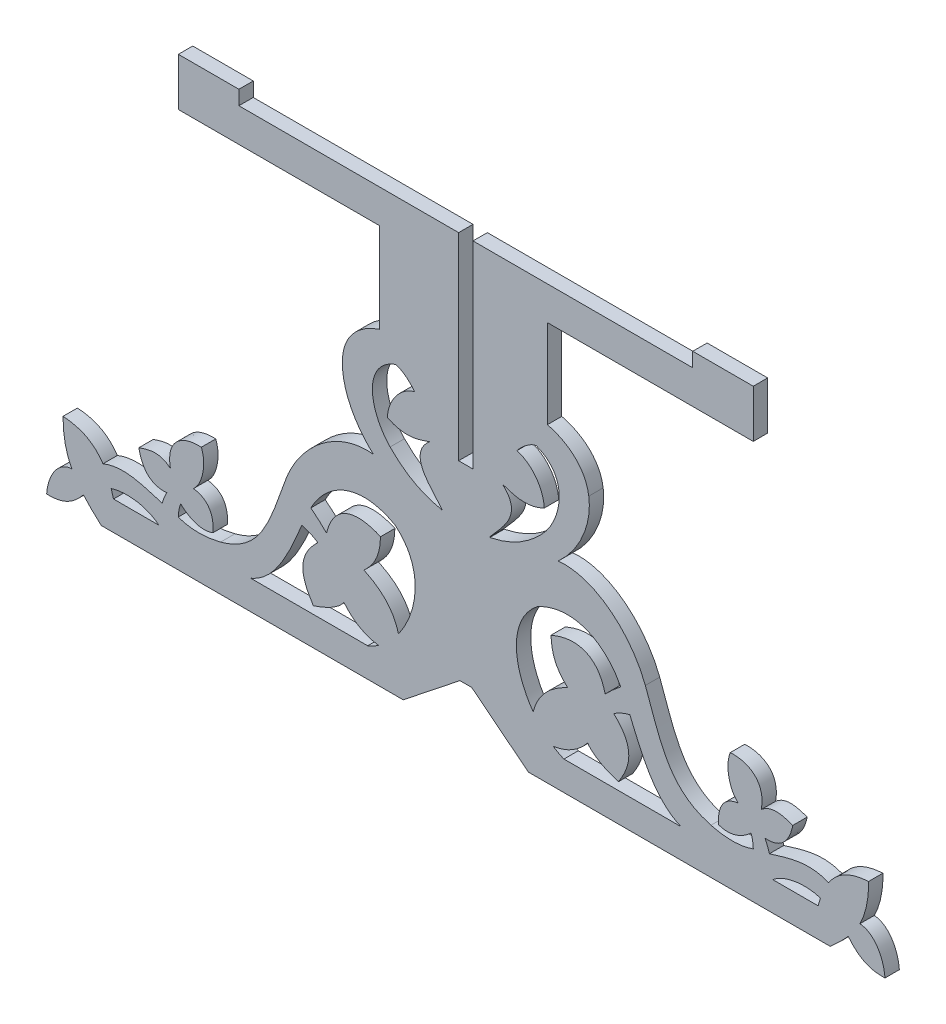
from build123d import *

# Parameters (mm, degrees)
RESSALTO_EXTRUS_O1_DEPTH = 2


with BuildPart() as part:
    # Model → Ressalto-extrusão1 (new body)
    with BuildSketch(Plane.XY):
        with BuildLine():
            Line((-10.7231, -37.6762), (-10.7231, -25.1897))
            Line((-10.7231, -25.1897), (-38.7386, -25.1897))
            add(Edge.make_bspline(
                [(-38.7386, -25.1897), (-38.7386, -22.9711), (-38.7386, -20.7524), (-38.7386, -18.5338)],
                knots=[0.360655738, 0.360655738, 0.360655738, 0.360655738, 0.37704918, 0.37704918, 0.37704918, 0.37704918], degree=3))
            Line((-38.7386, -18.5338), (-30.3175, -18.5338))
            Line((-30.3175, -18.5338), (-30.3175, -20.523))
            Line((-30.3175, -20.523), (0.2614, -20.523))
            Line((0.2614, -20.523), (0.2614, -48.0172))
            Line((0.2614, -48.0172), (2.2614, -48.0172))
            Line((2.2614, -48.0172), (2.2614, -20.523))
            Line((2.2614, -20.523), (32.8404, -20.523))
            Line((32.8404, -20.523), (32.8404, -18.5338))
            Line((32.8404, -18.5338), (41.2614, -18.5338))
            add(Edge.make_bspline(
                [(41.2614, -18.5338), (41.2614, -20.7524), (41.2614, -22.9711), (41.2614, -25.1897)],
                knots=[0.524590164, 0.524590164, 0.524590164, 0.524590164, 0.540983607, 0.540983607, 0.540983607, 0.540983607], degree=3))
            Line((41.2614, -25.1897), (12.6103, -25.1897))
            Line((12.6103, -25.1897), (12.6103, -37.4982))
            add(Edge.make_bspline(
                [(12.6103, -37.4982), (15.3469, -38.1638), (17.9338, -40.0649), (18.3727, -43.2265)],
                knots=[0.573770492, 0.573770492, 0.573770492, 0.573770492, 0.590163934, 0.590163934, 0.590163934, 0.590163934], degree=3))
            add(Edge.make_bspline(
                [(18.3727, -43.2265), (18.8013, -46.3127), (17.3679, -50.2251), (14.1216, -53.1702)],
                knots=[0.590163934, 0.590163934, 0.590163934, 0.590163934, 0.606557377, 0.606557377, 0.606557377, 0.606557377], degree=3))
            add(Edge.make_bspline(
                [(14.1216, -53.1702), (19.3303, -52.6163), (24.3698, -57.1289), (26.2431, -62.1023)],
                knots=[0.606557377, 0.606557377, 0.606557377, 0.606557377, 0.62295082, 0.62295082, 0.62295082, 0.62295082], degree=3))
            add(Edge.make_bspline(
                [(26.2431, -62.1023), (28.3786, -67.7721), (29.4175, -72.7859), (35.3799, -74.3775)],
                knots=[0.62295082, 0.62295082, 0.62295082, 0.62295082, 0.639344262, 0.639344262, 0.639344262, 0.639344262], degree=3))
            add(Edge.make_bspline(
                [(35.3799, -74.3775), (37.3294, -74.898), (39.4414, -74.984), (41.2622, -74.294)],
                knots=[0.639344262, 0.639344262, 0.639344262, 0.639344262, 0.655737705, 0.655737705, 0.655737705, 0.655737705], degree=3))
            add(Edge.make_bspline(
                [(41.2622, -74.294), (41.2806, -73.728), (41.1153, -72.9489), (40.9405, -72.5501)],
                knots=[0.655737705, 0.655737705, 0.655737705, 0.655737705, 0.672131148, 0.672131148, 0.672131148, 0.672131148], degree=3))
            add(Edge.make_bspline(
                [(40.9405, -72.5501), (39.6049, -73.7999), (37.9821, -74.3589), (36.4572, -73.7949)],
                knots=[0.672131148, 0.672131148, 0.672131148, 0.672131148, 0.68852459, 0.68852459, 0.68852459, 0.68852459], degree=3))
            add(Edge.make_bspline(
                [(36.4572, -73.7949), (36.2713, -72.4111), (36.6557, -70.1006), (39.179, -69.821)],
                knots=[0.68852459, 0.68852459, 0.68852459, 0.68852459, 0.704918033, 0.704918033, 0.704918033, 0.704918033], degree=3))
            add(Edge.make_bspline(
                [(39.179, -69.821), (37.9997, -68.8716), (37.2891, -66.2296), (38.0621, -64.285)],
                knots=[0.704918033, 0.704918033, 0.704918033, 0.704918033, 0.721311475, 0.721311475, 0.721311475, 0.721311475], degree=3))
            add(Edge.make_bspline(
                [(38.0621, -64.285), (40.7476, -64.1295), (43.0052, -65.6416), (42.3684, -69.0009)],
                knots=[0.721311475, 0.721311475, 0.721311475, 0.721311475, 0.737704918, 0.737704918, 0.737704918, 0.737704918], degree=3))
            add(Edge.make_bspline(
                [(42.3684, -69.0009), (43.6758, -67.8762), (45.0295, -68.0604), (46.7666, -68.7027)],
                knots=[0.737704918, 0.737704918, 0.737704918, 0.737704918, 0.754098361, 0.754098361, 0.754098361, 0.754098361], degree=3))
            add(Edge.make_bspline(
                [(46.7666, -68.7027), (46.3384, -70.7839), (45.2619, -72.3576), (42.8773, -72.1812)],
                knots=[0.754098361, 0.754098361, 0.754098361, 0.754098361, 0.770491803, 0.770491803, 0.770491803, 0.770491803], degree=3))
            add(Edge.make_bspline(
                [(42.8773, -72.1812), (43.2089, -72.8324), (43.3627, -73.2163), (43.5091, -73.7542)],
                knots=[0.770491803, 0.770491803, 0.770491803, 0.770491803, 0.786885246, 0.786885246, 0.786885246, 0.786885246], degree=3))
            add(Edge.make_bspline(
                [(43.5091, -73.7542), (46.2628, -72.9249), (48.9338, -71.9547), (51.7513, -73.1269)],
                knots=[0.786885246, 0.786885246, 0.786885246, 0.786885246, 0.803278689, 0.803278689, 0.803278689, 0.803278689], degree=3))
            add(Edge.make_bspline(
                [(51.7513, -73.1269), (52.9966, -71.2581), (54.7969, -70.3509), (57.3123, -70.1879)],
                knots=[0.803278689, 0.803278689, 0.803278689, 0.803278689, 0.819672131, 0.819672131, 0.819672131, 0.819672131], degree=3))
            add(Edge.make_bspline(
                [(57.3123, -70.1879), (57.3204, -72.5861), (56.8825, -74.3809), (56.0957, -75.8997)],
                knots=[0.819672131, 0.819672131, 0.819672131, 0.819672131, 0.836065574, 0.836065574, 0.836065574, 0.836065574], degree=3))
            add(Edge.make_bspline(
                [(56.0957, -75.8997), (57.9369, -75.9909), (59.3915, -78.0981), (59.5947, -80.6857)],
                knots=[0.836065574, 0.836065574, 0.836065574, 0.836065574, 0.852459016, 0.852459016, 0.852459016, 0.852459016], degree=3))
            add(Edge.make_bspline(
                [(59.5947, -80.6857), (57.7047, -80.7554), (56.1272, -80.2428), (54.5438, -78.3099)],
                knots=[0.852459016, 0.852459016, 0.852459016, 0.852459016, 0.868852459, 0.868852459, 0.868852459, 0.868852459], degree=3))
            add(Edge.make_bspline(
                [(54.5438, -78.3099), (54.5231, -78.2819), (54.5016, -78.2553), (54.4806, -78.2277)],
                knots=[0.868852459, 0.868852459, 0.868852459, 0.868852459, 0.885245902, 0.885245902, 0.885245902, 0.885245902], degree=3))
            add(Edge.make_bspline(
                [(54.4806, -78.2277), (53.7575, -79.0574), (52.9166, -79.8491), (51.9814, -80.6856)],
                knots=[0.885245902, 0.885245902, 0.885245902, 0.885245902, 0.901639344, 0.901639344, 0.901639344, 0.901639344], degree=3))
            Line((51.9814, -80.6856), (9.9729, -80.6856))
            Line((9.9729, -80.6856), (2.0788, -74.4249))
            Line((2.0788, -74.4249), (0.4441, -74.4249))
            Line((0.4441, -74.4249), (-7.45, -80.6856))
            Line((-7.45, -80.6856), (-49.4585, -80.6856))
            add(Edge.make_bspline(
                [(-49.4585, -80.6856), (-50.3937, -79.8491), (-51.2347, -79.0574), (-51.9577, -78.2277)],
                knots=[0, 0, 0, 0, 0.016393443, 0.016393443, 0.016393443, 0.016393443], degree=3))
            add(Edge.make_bspline(
                [(-51.9577, -78.2277), (-51.9788, -78.2553), (-52.0002, -78.2819), (-52.021, -78.3099)],
                knots=[0.016393443, 0.016393443, 0.016393443, 0.016393443, 0.032786885, 0.032786885, 0.032786885, 0.032786885], degree=3))
            add(Edge.make_bspline(
                [(-52.021, -78.3099), (-53.6044, -80.2428), (-55.1819, -80.7554), (-57.0719, -80.6857)],
                knots=[0.032786885, 0.032786885, 0.032786885, 0.032786885, 0.049180328, 0.049180328, 0.049180328, 0.049180328], degree=3))
            add(Edge.make_bspline(
                [(-57.0719, -80.6857), (-56.8686, -78.0981), (-55.414, -75.9909), (-53.5728, -75.8997)],
                knots=[0.049180328, 0.049180328, 0.049180328, 0.049180328, 0.06557377, 0.06557377, 0.06557377, 0.06557377], degree=3))
            add(Edge.make_bspline(
                [(-53.5728, -75.8997), (-54.3597, -74.3809), (-54.7976, -72.5861), (-54.7895, -70.1879)],
                knots=[0.06557377, 0.06557377, 0.06557377, 0.06557377, 0.081967213, 0.081967213, 0.081967213, 0.081967213], degree=3))
            add(Edge.make_bspline(
                [(-54.7895, -70.1879), (-52.2741, -70.3509), (-50.4738, -71.2581), (-49.2284, -73.1269)],
                knots=[0.081967213, 0.081967213, 0.081967213, 0.081967213, 0.098360656, 0.098360656, 0.098360656, 0.098360656], degree=3))
            add(Edge.make_bspline(
                [(-49.2284, -73.1269), (-46.411, -71.9547), (-43.74, -72.9249), (-40.9862, -73.7542)],
                knots=[0.098360656, 0.098360656, 0.098360656, 0.098360656, 0.114754098, 0.114754098, 0.114754098, 0.114754098], degree=3))
            add(Edge.make_bspline(
                [(-40.9862, -73.7542), (-40.8398, -73.2163), (-40.686, -72.8324), (-40.3544, -72.1812)],
                knots=[0.114754098, 0.114754098, 0.114754098, 0.114754098, 0.131147541, 0.131147541, 0.131147541, 0.131147541], degree=3))
            add(Edge.make_bspline(
                [(-40.3544, -72.1812), (-42.739, -72.3576), (-43.8155, -70.7839), (-44.2438, -68.7027)],
                knots=[0.131147541, 0.131147541, 0.131147541, 0.131147541, 0.147540984, 0.147540984, 0.147540984, 0.147540984], degree=3))
            add(Edge.make_bspline(
                [(-44.2438, -68.7027), (-42.5066, -68.0604), (-41.153, -67.8762), (-39.8456, -69.0009)],
                knots=[0.147540984, 0.147540984, 0.147540984, 0.147540984, 0.163934426, 0.163934426, 0.163934426, 0.163934426], degree=3))
            add(Edge.make_bspline(
                [(-39.8456, -69.0009), (-40.4823, -65.6416), (-38.2247, -64.1295), (-35.5393, -64.285)],
                knots=[0.163934426, 0.163934426, 0.163934426, 0.163934426, 0.180327869, 0.180327869, 0.180327869, 0.180327869], degree=3))
            add(Edge.make_bspline(
                [(-35.5393, -64.285), (-34.7662, -66.2296), (-35.4768, -68.8716), (-36.6561, -69.821)],
                knots=[0.180327869, 0.180327869, 0.180327869, 0.180327869, 0.196721311, 0.196721311, 0.196721311, 0.196721311], degree=3))
            add(Edge.make_bspline(
                [(-36.6561, -69.821), (-34.1328, -70.1006), (-33.7484, -72.4111), (-33.9344, -73.7949)],
                knots=[0.196721311, 0.196721311, 0.196721311, 0.196721311, 0.213114754, 0.213114754, 0.213114754, 0.213114754], degree=3))
            add(Edge.make_bspline(
                [(-33.9344, -73.7949), (-35.4592, -74.3589), (-37.082, -73.7999), (-38.4177, -72.5501)],
                knots=[0.213114754, 0.213114754, 0.213114754, 0.213114754, 0.229508197, 0.229508197, 0.229508197, 0.229508197], degree=3))
            add(Edge.make_bspline(
                [(-38.4177, -72.5501), (-38.5924, -72.9489), (-38.7578, -73.728), (-38.7393, -74.294)],
                knots=[0.229508197, 0.229508197, 0.229508197, 0.229508197, 0.245901639, 0.245901639, 0.245901639, 0.245901639], degree=3))
            add(Edge.make_bspline(
                [(-38.7393, -74.294), (-36.9185, -74.984), (-34.8066, -74.898), (-32.8571, -74.3775)],
                knots=[0.245901639, 0.245901639, 0.245901639, 0.245901639, 0.262295082, 0.262295082, 0.262295082, 0.262295082], degree=3))
            add(Edge.make_bspline(
                [(-32.8571, -74.3775), (-26.8946, -72.7859), (-25.8557, -67.7721), (-23.7202, -62.1023)],
                knots=[0.262295082, 0.262295082, 0.262295082, 0.262295082, 0.278688525, 0.278688525, 0.278688525, 0.278688525], degree=3))
            add(Edge.make_bspline(
                [(-23.7202, -62.1023), (-21.8469, -57.1289), (-16.8074, -52.6163), (-11.5988, -53.1702)],
                knots=[0.278688525, 0.278688525, 0.278688525, 0.278688525, 0.295081967, 0.295081967, 0.295081967, 0.295081967], degree=3))
            add(Edge.make_bspline(
                [(-11.5988, -53.1702), (-14.8451, -50.2251), (-16.2784, -46.3127), (-15.8499, -43.2265)],
                knots=[0.295081967, 0.295081967, 0.295081967, 0.295081967, 0.31147541, 0.31147541, 0.31147541, 0.31147541], degree=3))
            add(Edge.make_bspline(
                [(-15.8499, -43.2265), (-15.4451, -40.3111), (-13.2139, -38.4676), (-10.7231, -37.6762)],
                knots=[0.31147541, 0.31147541, 0.31147541, 0.31147541, 0.327868852, 0.327868852, 0.327868852, 0.327868852], degree=3))
        make_face()
        with BuildLine():
            Line((4.593, -55.0228), (4.593, -55.1006))
            add(Edge.make_bspline(
                [(4.593, -55.1006), (7.4607, -54.4947), (9.6337, -53.3337), (11.7968, -51.1256)],
                knots=[0.111111111, 0.111111111, 0.111111111, 0.111111111, 0.222222222, 0.222222222, 0.222222222, 0.222222222], degree=3))
            add(Edge.make_bspline(
                [(11.7968, -51.1256), (14.6104, -48.2536), (15.7932, -42.5892), (11.0703, -40.8025)],
                knots=[0.222222222, 0.222222222, 0.222222222, 0.222222222, 0.333333333, 0.333333333, 0.333333333, 0.333333333], degree=3))
            Line((11.0703, -40.8025), (10.995, -40.8025))
            add(Edge.make_bspline(
                [(10.995, -40.8025), (10.0422, -40.9908), (8.9013, -42.0568), (8.3751, -42.7392)],
                knots=[0.444444444, 0.444444444, 0.444444444, 0.444444444, 0.555555556, 0.555555556, 0.555555556, 0.555555556], degree=3))
            add(Edge.make_bspline(
                [(8.3751, -42.7392), (10.5216, -43.3581), (12.0847, -45.5727), (12.1767, -47.7616)],
                knots=[0.555555556, 0.555555556, 0.555555556, 0.555555556, 0.666666667, 0.666666667, 0.666666667, 0.666666667], degree=3))
            add(Edge.make_bspline(
                [(12.1767, -47.7616), (9.9511, -48.8776), (8.1387, -48.4392), (6.3426, -47.765)],
                knots=[0.666666667, 0.666666667, 0.666666667, 0.666666667, 0.777777778, 0.777777778, 0.777777778, 0.777777778], degree=3))
            add(Edge.make_bspline(
                [(6.3426, -47.765), (9.272, -50.3777), (6.4959, -52.7581), (4.593, -55.0228)],
                knots=[0.777777778, 0.777777778, 0.777777778, 0.777777778, 1, 1, 1, 1], degree=3))
        make_face(mode=Mode.SUBTRACT)
        with BuildLine():
            Line((-2.0702, -55.1006), (-2.0702, -55.0229))
            add(Edge.make_bspline(
                [(-2.0702, -55.0229), (-3.973, -52.7582), (-6.7492, -50.3777), (-3.8197, -47.765)],
                knots=[0.111111111, 0.111111111, 0.111111111, 0.111111111, 0.222222222, 0.222222222, 0.222222222, 0.222222222], degree=3))
            add(Edge.make_bspline(
                [(-3.8197, -47.765), (-5.6159, -48.4392), (-7.4282, -48.8776), (-9.6538, -47.7616)],
                knots=[0.222222222, 0.222222222, 0.222222222, 0.222222222, 0.333333333, 0.333333333, 0.333333333, 0.333333333], degree=3))
            add(Edge.make_bspline(
                [(-9.6538, -47.7616), (-9.5618, -45.5727), (-7.9987, -43.3581), (-5.8522, -42.7392)],
                knots=[0.333333333, 0.333333333, 0.333333333, 0.333333333, 0.444444444, 0.444444444, 0.444444444, 0.444444444], degree=3))
            add(Edge.make_bspline(
                [(-5.8522, -42.7392), (-6.3784, -42.0568), (-7.5194, -40.9908), (-8.4723, -40.8025)],
                knots=[0.444444444, 0.444444444, 0.444444444, 0.444444444, 0.555555556, 0.555555556, 0.555555556, 0.555555556], degree=3))
            Line((-8.4723, -40.8025), (-8.5475, -40.8025))
            add(Edge.make_bspline(
                [(-8.5475, -40.8025), (-13.2704, -42.5892), (-12.0875, -48.2536), (-9.274, -51.1256)],
                knots=[0.666666667, 0.666666667, 0.666666667, 0.666666667, 0.777777778, 0.777777778, 0.777777778, 0.777777778], degree=3))
            add(Edge.make_bspline(
                [(-9.274, -51.1256), (-7.1108, -53.3337), (-4.9378, -54.4947), (-2.0702, -55.1006)],
                knots=[0.777777778, 0.777777778, 0.777777778, 0.777777778, 1, 1, 1, 1], degree=3))
        make_face(mode=Mode.SUBTRACT)
        with BuildLine():
            Line((31.2032, -76.6403), (14.9136, -76.6403))
            add(Edge.make_bspline(
                [(14.9136, -76.6403), (14.3993, -76.4413), (13.8945, -76.1717), (13.4069, -75.8435)],
                knots=[0.75, 0.75, 0.75, 0.75, 1, 1, 1, 1], degree=3))
            add(Edge.make_bspline(
                [(13.4069, -75.8435), (15.2432, -75.5811), (16.8695, -74.7264), (18.2249, -73.0522)],
                knots=[0, 0, 0, 0, 0.125, 0.125, 0.125, 0.125], degree=3))
            add(Edge.make_bspline(
                [(18.2249, -73.0522), (19.0084, -74.2501), (21.0144, -75.1409), (22.4861, -75.594)],
                knots=[0.125, 0.125, 0.125, 0.125, 0.25, 0.25, 0.25, 0.25], degree=3))
            add(Edge.make_bspline(
                [(22.4861, -75.594), (24.1211, -73.1005), (24.9424, -70.5429), (21.8417, -67.6767)],
                knots=[0.25, 0.25, 0.25, 0.25, 0.375, 0.375, 0.375, 0.375], degree=3))
            add(Edge.make_bspline(
                [(21.8417, -67.6767), (22.5603, -67.2185), (23.3218, -66.8869), (24.0798, -66.6989)],
                knots=[0.375, 0.375, 0.375, 0.375, 0.5, 0.5, 0.5, 0.5], degree=3))
            add(Edge.make_bspline(
                [(24.0798, -66.6989), (25.6529, -70.3508), (27.4424, -75.0949), (31.2032, -76.6403)],
                knots=[0.5, 0.5, 0.5, 0.5, 0.625, 0.625, 0.625, 0.625], degree=3))
        make_face(mode=Mode.SUBTRACT)
        with BuildLine():
            Line((50.289, -76.6403), (43.9782, -76.6403))
            add(Edge.make_bspline(
                [(43.9782, -76.6403), (45.4021, -75.4281), (48.0767, -74.7811), (50.6137, -75.5322)],
                knots=[0.5, 0.5, 0.5, 0.5, 1, 1, 1, 1], degree=3))
            add(Edge.make_bspline(
                [(50.6137, -75.5322), (50.4966, -75.8825), (50.3884, -76.2514), (50.289, -76.6403)],
                knots=[0, 0, 0, 0, 0.25, 0.25, 0.25, 0.25], degree=3))
        make_face(mode=Mode.SUBTRACT)
        with BuildLine():
            Line((-28.6803, -76.6403), (-12.3907, -76.6403))
            add(Edge.make_bspline(
                [(-12.3907, -76.6403), (-11.8765, -76.4413), (-11.3717, -76.1717), (-10.884, -75.8435)],
                knots=[0.75, 0.75, 0.75, 0.75, 1, 1, 1, 1], degree=3))
            add(Edge.make_bspline(
                [(-10.884, -75.8435), (-12.7203, -75.5811), (-14.3466, -74.7264), (-15.7021, -73.0522)],
                knots=[0, 0, 0, 0, 0.125, 0.125, 0.125, 0.125], degree=3))
            add(Edge.make_bspline(
                [(-15.7021, -73.0522), (-16.4855, -74.2501), (-18.4916, -75.1409), (-19.9632, -75.594)],
                knots=[0.125, 0.125, 0.125, 0.125, 0.25, 0.25, 0.25, 0.25], degree=3))
            add(Edge.make_bspline(
                [(-19.9632, -75.594), (-21.5983, -73.1005), (-22.4196, -70.5429), (-19.3188, -67.6767)],
                knots=[0.25, 0.25, 0.25, 0.25, 0.375, 0.375, 0.375, 0.375], degree=3))
            add(Edge.make_bspline(
                [(-19.3188, -67.6767), (-20.0374, -67.2185), (-20.7989, -66.8869), (-21.557, -66.6989)],
                knots=[0.375, 0.375, 0.375, 0.375, 0.5, 0.5, 0.5, 0.5], degree=3))
            add(Edge.make_bspline(
                [(-21.557, -66.6989), (-23.1301, -70.3508), (-24.9195, -75.0949), (-28.6803, -76.6403)],
                knots=[0.5, 0.5, 0.5, 0.5, 0.625, 0.625, 0.625, 0.625], degree=3))
        make_face(mode=Mode.SUBTRACT)
        with BuildLine():
            Line((-47.7662, -76.6403), (-41.4553, -76.6403))
            add(Edge.make_bspline(
                [(-41.4553, -76.6403), (-42.8792, -75.4281), (-45.5538, -74.7811), (-48.0908, -75.5322)],
                knots=[0.5, 0.5, 0.5, 0.5, 1, 1, 1, 1], degree=3))
            add(Edge.make_bspline(
                [(-48.0908, -75.5322), (-47.9737, -75.8825), (-47.8655, -76.2514), (-47.7662, -76.6403)],
                knots=[0, 0, 0, 0, 0.25, 0.25, 0.25, 0.25], degree=3))
        make_face(mode=Mode.SUBTRACT)
        with BuildLine():
            add(Edge.make_bspline(
                [(11.1779, -60.1432), (15.7255, -57.6243), (20.4073, -59.3728), (22.8252, -63.985)],
                knots=[0, 0, 0, 0, 0.142857143, 0.142857143, 0.142857143, 0.142857143], degree=3))
            add(Edge.make_bspline(
                [(22.8252, -63.985), (22.0172, -64.6261), (21.246, -65.3009), (20.6496, -65.9328)],
                knots=[0.142857143, 0.142857143, 0.142857143, 0.142857143, 0.285714286, 0.285714286, 0.285714286, 0.285714286], degree=3))
            add(Edge.make_bspline(
                [(20.6496, -65.9328), (19.5974, -61.6749), (16.4549, -61.1629), (13.1258, -62.6016)],
                knots=[0.285714286, 0.285714286, 0.285714286, 0.285714286, 0.428571429, 0.428571429, 0.428571429, 0.428571429], degree=3))
            add(Edge.make_bspline(
                [(13.1258, -62.6016), (13.1923, -64.5173), (13.6493, -66.1778), (15.4372, -67.7712)],
                knots=[0.428571429, 0.428571429, 0.428571429, 0.428571429, 0.571428571, 0.571428571, 0.571428571, 0.571428571], degree=3))
            add(Edge.make_bspline(
                [(15.4372, -67.7712), (13.0142, -68.9095), (11.2762, -70.5694), (10.6359, -73.0882)],
                knots=[0.571428571, 0.571428571, 0.571428571, 0.571428571, 0.714285714, 0.714285714, 0.714285714, 0.714285714], degree=3))
            add(Edge.make_bspline(
                [(10.6359, -73.0882), (7.8828, -69.2377), (6.9885, -63.4865), (11.1779, -60.1432)],
                knots=[0.714285714, 0.714285714, 0.714285714, 0.714285714, 1, 1, 1, 1], degree=3))
        make_face(mode=Mode.SUBTRACT)
        with BuildLine():
            add(Edge.make_bspline(
                [(-8.6551, -60.1432), (-13.2026, -57.6243), (-17.8845, -59.3728), (-20.3024, -63.985)],
                knots=[0, 0, 0, 0, 0.142857143, 0.142857143, 0.142857143, 0.142857143], degree=3))
            add(Edge.make_bspline(
                [(-20.3024, -63.985), (-19.4943, -64.6261), (-18.7232, -65.3009), (-18.1268, -65.9328)],
                knots=[0.142857143, 0.142857143, 0.142857143, 0.142857143, 0.285714286, 0.285714286, 0.285714286, 0.285714286], degree=3))
            add(Edge.make_bspline(
                [(-18.1268, -65.9328), (-17.0746, -61.6749), (-13.932, -61.1629), (-10.6029, -62.6016)],
                knots=[0.285714286, 0.285714286, 0.285714286, 0.285714286, 0.428571429, 0.428571429, 0.428571429, 0.428571429], degree=3))
            add(Edge.make_bspline(
                [(-10.6029, -62.6016), (-10.6694, -64.5173), (-11.1264, -66.1778), (-12.9143, -67.7712)],
                knots=[0.428571429, 0.428571429, 0.428571429, 0.428571429, 0.571428571, 0.571428571, 0.571428571, 0.571428571], degree=3))
            add(Edge.make_bspline(
                [(-12.9143, -67.7712), (-10.4913, -68.9095), (-8.7533, -70.5694), (-8.113, -73.0882)],
                knots=[0.571428571, 0.571428571, 0.571428571, 0.571428571, 0.714285714, 0.714285714, 0.714285714, 0.714285714], degree=3))
            add(Edge.make_bspline(
                [(-8.113, -73.0882), (-5.3599, -69.2377), (-4.4657, -63.4865), (-8.6551, -60.1432)],
                knots=[0.714285714, 0.714285714, 0.714285714, 0.714285714, 1, 1, 1, 1], degree=3))
        make_face(mode=Mode.SUBTRACT)
    extrude(amount=RESSALTO_EXTRUS_O1_DEPTH)


solid = part.part
